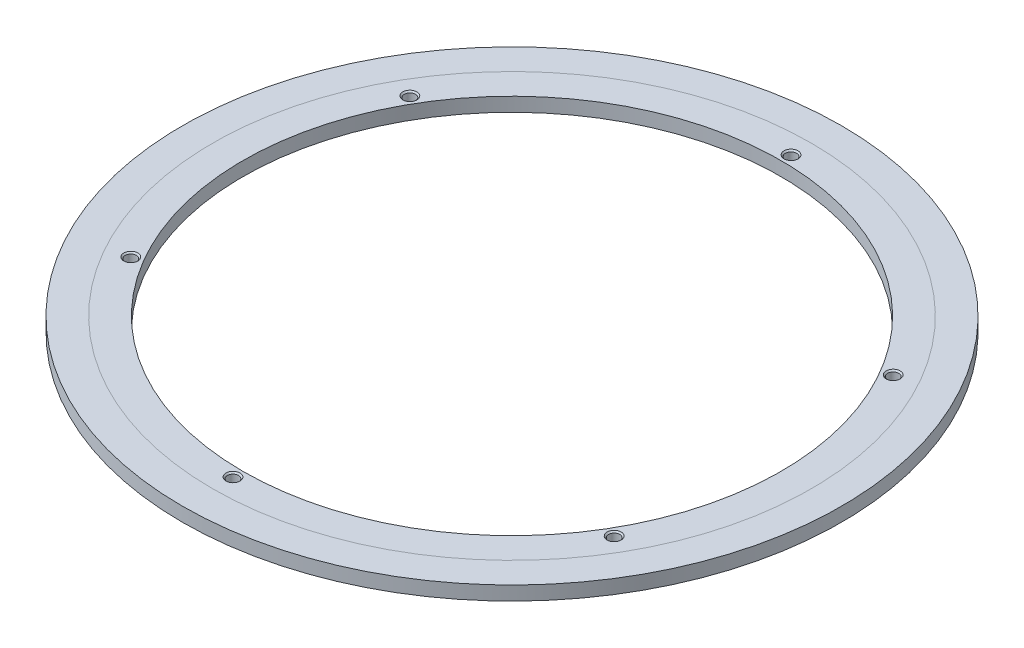
from build123d import *

# Parameters (mm, degrees)
SKETCH1_R                       = 150
SKETCH1_R_2                     = 136.25
BOSS_EXTRUDE1_DEPTH             = 6.35
SKETCH1_3_R                     = 136.25
SKETCH1_3_R_2                   = 122.5
BOSS_EXTRUDE2_DEPTH             = 6.35
F_10_CLEARANCE_HOLE1_AT_2_COUNT = 2
F_10_CLEARANCE_HOLE1_AT_2_PITCH = 127
F_10_CLEARANCE_HOLE1_AT_3_COUNT = 2
F_10_CLEARANCE_HOLE1_AT_3_PITCH = 219.970452561
F_10_CLEARANCE_HOLE1_AT_4_COUNT = 2
F_10_CLEARANCE_HOLE1_AT_4_PITCH = 254
F_10_CLEARANCE_HOLE1_AT_5_COUNT = 2
F_10_CLEARANCE_HOLE1_AT_5_PITCH = 219.970452561
F_10_CLEARANCE_HOLE1_AT_6_COUNT = 2
F_10_CLEARANCE_HOLE1_AT_6_PITCH = 127


with BuildPart() as part:
    # Sketch1 → Boss-Extrude1 (new body)
    with BuildSketch(Plane(origin=(0, 0, 0), x_dir=(1, 0, 0), z_dir=(0, 1, 0))):
        Circle(SKETCH1_R)
        Circle(SKETCH1_R_2, mode=Mode.SUBTRACT)
    extrude(amount=-BOSS_EXTRUDE1_DEPTH)


with BuildPart() as body_2:
    # Sketch1<3> → Boss-Extrude2 (new body)
    with BuildSketch(Plane(origin=(0, 0, 0), x_dir=(1, 0, 0), z_dir=(0, 1, 0))):
        Circle(SKETCH1_3_R)
        Circle(SKETCH1_3_R_2, mode=Mode.SUBTRACT)
    extrude(amount=-BOSS_EXTRUDE2_DEPTH)

    # Sketch3 → #10 Clearance Hole1 (revolve, cut)
    with BuildSketch(Plane(origin=(-109.985226281, 0, -63.5), x_dir=(0, 0, 1), z_dir=(1, 0, 0))):
        Polygon((0, 0), (0, 6.35), (3.1877, 6.35), (2.5527, 5.715), (2.5527, 0.635), (3.1877, 0), align=None)
    f_10_clearance_hole1 = revolve(axis=Axis((-109.985226281, 6.35, -63.5), (0, -1, 0)), mode=Mode.SUBTRACT)

    # #10 Clearance Hole1 at 2: #10 Clearance Hole1 ×2
    with Locations(*[Vector(0.8660254037844387, 0, -0.5) * (i * F_10_CLEARANCE_HOLE1_AT_2_PITCH) for i in range(1, F_10_CLEARANCE_HOLE1_AT_2_COUNT)]):
        add(f_10_clearance_hole1, mode=Mode.SUBTRACT)

    # #10 Clearance Hole1 at 3: #10 Clearance Hole1 ×2
    with Locations(*[(i * F_10_CLEARANCE_HOLE1_AT_3_PITCH, 0, 0) for i in range(1, F_10_CLEARANCE_HOLE1_AT_3_COUNT)]):
        add(f_10_clearance_hole1, mode=Mode.SUBTRACT)

    # #10 Clearance Hole1 at 4: #10 Clearance Hole1 ×2
    with Locations(*[Vector(0.8660254037844387, 0, 0.49999999999999994) * (i * F_10_CLEARANCE_HOLE1_AT_4_PITCH) for i in range(1, F_10_CLEARANCE_HOLE1_AT_4_COUNT)]):
        add(f_10_clearance_hole1, mode=Mode.SUBTRACT)

    # #10 Clearance Hole1 at 5: #10 Clearance Hole1 ×2
    with Locations(*[Vector(0.5, 0, 0.8660254037844387) * (i * F_10_CLEARANCE_HOLE1_AT_5_PITCH) for i in range(1, F_10_CLEARANCE_HOLE1_AT_5_COUNT)]):
        add(f_10_clearance_hole1, mode=Mode.SUBTRACT)

    # #10 Clearance Hole1 at 6: #10 Clearance Hole1 ×2
    with Locations(*[(0, 0, i * F_10_CLEARANCE_HOLE1_AT_6_PITCH) for i in range(1, F_10_CLEARANCE_HOLE1_AT_6_COUNT)]):
        add(f_10_clearance_hole1, mode=Mode.SUBTRACT)


solid = Compound([part.part, body_2.part])
